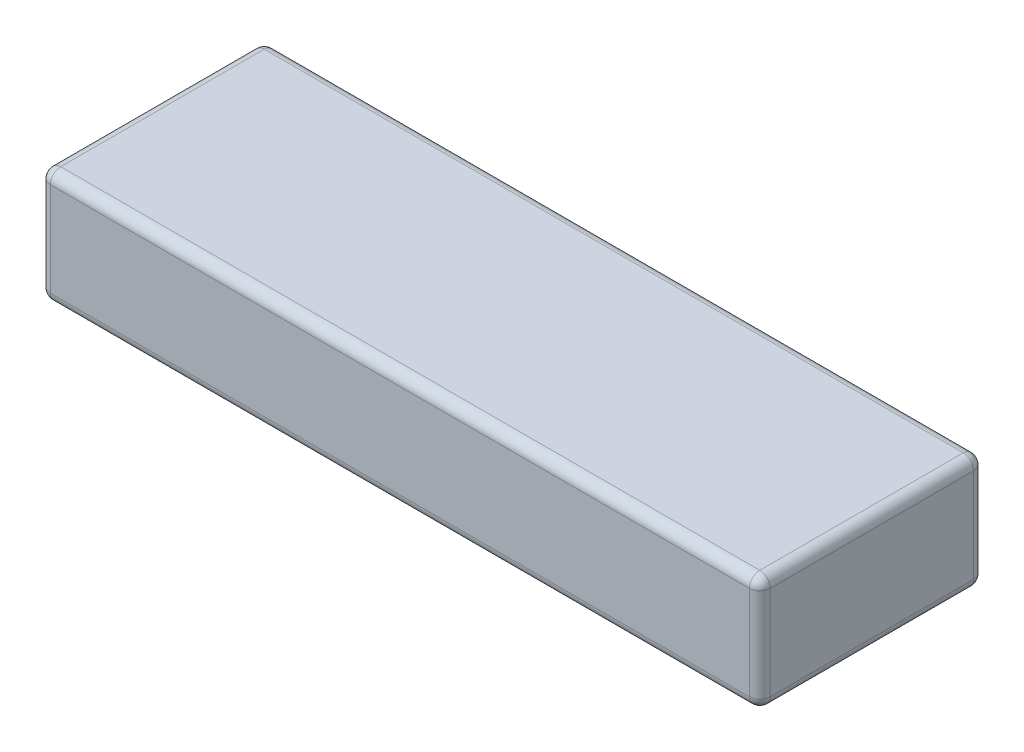
from build123d import *

# Parameters (mm, degrees)
SKIZZE1_W          = 138
SKIZZE1_H          = 43
GRUNDKOERPER_DEPTH = 22
VERRUNDUNG1_R      = 2


with BuildPart() as part:
    # Skizze1 → Grundkoerper (new body)
    with BuildSketch(Plane(origin=(0, 0, 0), x_dir=(1, 0, 0), z_dir=(0, 1, 0))):
        Rectangle(SKIZZE1_W, SKIZZE1_H)
    extrude(amount=GRUNDKOERPER_DEPTH)

    # Verrundung1
    verrundung1_edges = [part.edges().sort_by_distance(p)[0] for p in [
        (69, 0, 0),
        (0, 0, -21.5),
        (-69, 0, 0),
        (0, 0, 21.5),
        (-69, 11, 21.5),
        (-69, 11, -21.5),
        (69, 11, -21.5),
        (69, 11, 21.5),
        (69, 22, 0),
        (0, 22, -21.5),
        (-69, 22, 0),
        (0, 22, 21.5),
    ]]
    fillet(verrundung1_edges, radius=VERRUNDUNG1_R)


solid = part.part
